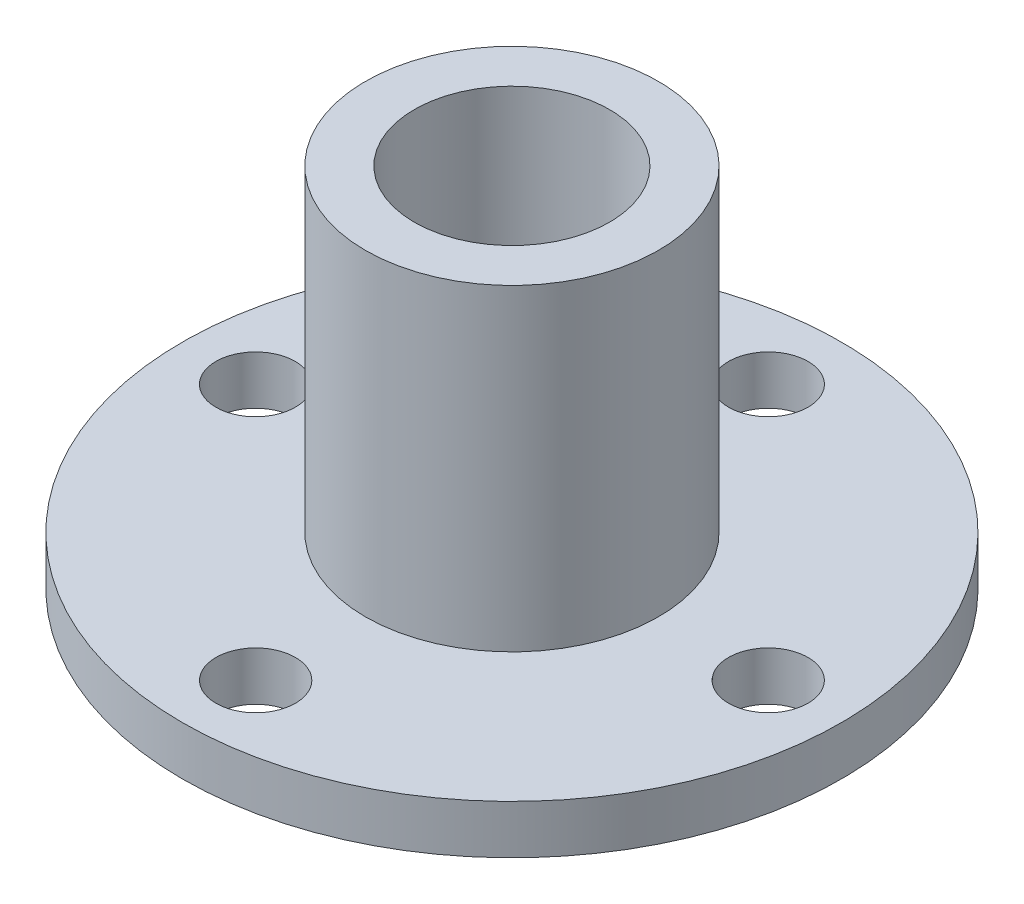
from build123d import *

# Parameters (mm, degrees)
SKETCH_1_R      = 13.5
SKETCH_1_R_2    = 1.627163834
SKETCH_1_R_3    = 6
SKETCH_1_R_4    = 4
EXTRUDE_3_DEPTH = 2
SKETCH_2_R      = 6
SKETCH_2_R_2    = 4
EXTRUDE_4_DEPTH = 15


with BuildPart() as part:
    # 草图1 → 凸台-拉伸3 (new body)
    # profile 1 of 2: a face of its own
    with BuildSketch(Plane(origin=(0, 0, 0), x_dir=(1, 0, 0), z_dir=(0, 1, 0))):
        with Locations(Location((0, 0, 0), (0, 0, 270))):
            Circle(SKETCH_1_R)
        with Locations(Location((-10.5, 0, 0), (0, 0, 270))):
            Circle(SKETCH_1_R_2, mode=Mode.SUBTRACT)
        with Locations(Location((0.002142639, -10.498928517, 0), (0, 0, 270))):
            Circle(SKETCH_1_R_2, mode=Mode.SUBTRACT)
        with Locations(Location((10.5, 0, 0), (0, 0, 270))):
            Circle(SKETCH_1_R_2, mode=Mode.SUBTRACT)
        with Locations(Location((0, 10.501071374, 0), (0, 0, 270))):
            Circle(SKETCH_1_R_2, mode=Mode.SUBTRACT)
        Circle(SKETCH_1_R_3, mode=Mode.SUBTRACT)
    # profile 2 of 2: a face of its own
    with BuildSketch(Plane(origin=(0, 0, 0), x_dir=(1, 0, 0), z_dir=(0, 1, 0))):
        Circle(SKETCH_1_R_3)
        with Locations(Location((0, 0, 0), (0, 0, 270))):
            Circle(SKETCH_1_R_4, mode=Mode.SUBTRACT)
    extrude(amount=EXTRUDE_3_DEPTH)

    # 草图2 → 凸台-拉伸4 (add)
    with BuildSketch(Plane(origin=(0, 0, 0), x_dir=(1, 0, 0), z_dir=(0, 1, 0))):
        with Locations(Location((0, 0, 0), (0, 0, 270))):
            Circle(SKETCH_2_R)
        with Locations(Location((0, 0, 0), (0, 0, 270))):
            Circle(SKETCH_2_R_2, mode=Mode.SUBTRACT)
    extrude(amount=EXTRUDE_4_DEPTH)


solid = part.part
